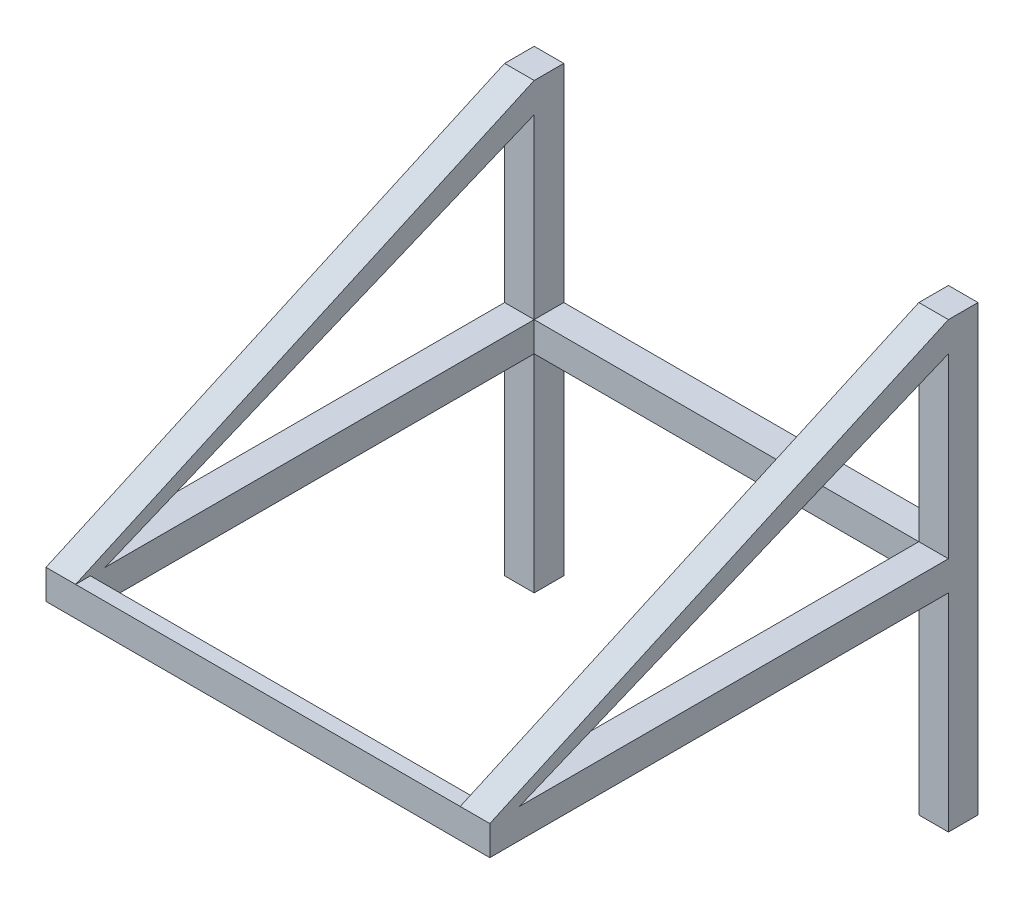
from build123d import *

# Parameters (mm, degrees)
SKETCH1_W           = 1524
SKETCH1_H           = 1524
BOSS_EXTRUDE1_DEPTH = 101.6
SKETCH2_W           = 1320.8
SKETCH2_H           = 711.2
CUT_EXTRUDE1_DEPTH  = 2158.65487509
SKETCH3_W           = 101.6
SKETCH3_H           = 101.6
BOSS_EXTRUDE2_DEPTH = 1524
SKETCH4_W           = 1524
SKETCH4_H           = 101.6
BOSS_EXTRUDE3_DEPTH = 50.8


with BuildPart() as part:
    # Sketch1 → Boss-Extrude1 (new body)
    with BuildSketch(Plane.XY):
        with Locations((762, 762)):
            Rectangle(SKETCH1_W, SKETCH1_H)
    extrude(amount=BOSS_EXTRUDE1_DEPTH)

    # Sketch2 → Cut-Extrude1 (cut, through all)
    with BuildSketch(Plane.XY.offset(101.6)):
        with Locations((762, 1168.4)):
            Rectangle(SKETCH2_W, SKETCH2_H)
        with Locations((762, 355.6)):
            Rectangle(SKETCH2_W, SKETCH2_H)
    extrude(amount=-CUT_EXTRUDE1_DEPTH, mode=Mode.SUBTRACT)

    # Sketch3 → Boss-Extrude2 (add)
    with BuildSketch(Plane.XY.offset(101.6)):
        with Locations((50.8, 762)):
            Rectangle(SKETCH3_W, SKETCH3_H)
        with Locations((1473.2, 762)):
            Rectangle(SKETCH3_W, SKETCH3_H)
    extrude(amount=BOSS_EXTRUDE2_DEPTH)

    # Sketch4 → Boss-Extrude3 (add)
    with BuildSketch(Plane.XY.offset(1625.6)):
        with Locations((762, 762)):
            Rectangle(SKETCH4_W, SKETCH4_H)
    extrude(amount=BOSS_EXTRUDE3_DEPTH)

    # Sketch6 → Loft1 section 0
    with BuildSketch(Plane(origin=(0, 812.8, 0), x_dir=(1, 0, 0), z_dir=(0, 1, 0))):
        with BuildLine():
            Line((1524, -1676.4), (1422.4, -1676.4))
            Line((1422.4, -1676.4), (1422.4, -1574.8))
            Line((1422.4, -1574.8), (1524, -1574.8))
            Line((1524, -1574.8), (1524, -1676.4))
        make_face()
    # Sketch5 → Loft1 section 1
    with BuildSketch(Plane.XY.offset(101.6)):
        with BuildLine():
            Line((1422.4, 1524), (1524, 1524))
            Line((1524, 1524), (1524, 1422.4))
            Line((1524, 1422.4), (1422.4, 1422.4))
            Line((1422.4, 1422.4), (1422.4, 1524))
        make_face()
    loft()

    # Sketch14 → Loft2 section 0
    with BuildSketch(Plane(origin=(0, 812.8, 0), x_dir=(1, 0, 0), z_dir=(0, 1, 0))):
        with BuildLine():
            Line((0, -1676.4), (101.6, -1676.4))
            Line((101.6, -1676.4), (101.6, -1574.8))
            Line((101.6, -1574.8), (0, -1574.8))
            Line((0, -1574.8), (0, -1676.4))
        make_face()
    # Sketch13 → Loft2 section 1
    with BuildSketch(Plane.XY.offset(101.6)):
        with BuildLine():
            Line((0, 1524), (101.6, 1524))
            Line((101.6, 1524), (101.6, 1422.4))
            Line((101.6, 1422.4), (0, 1422.4))
            Line((0, 1422.4), (0, 1524))
        make_face()
    loft()


solid = part.part
